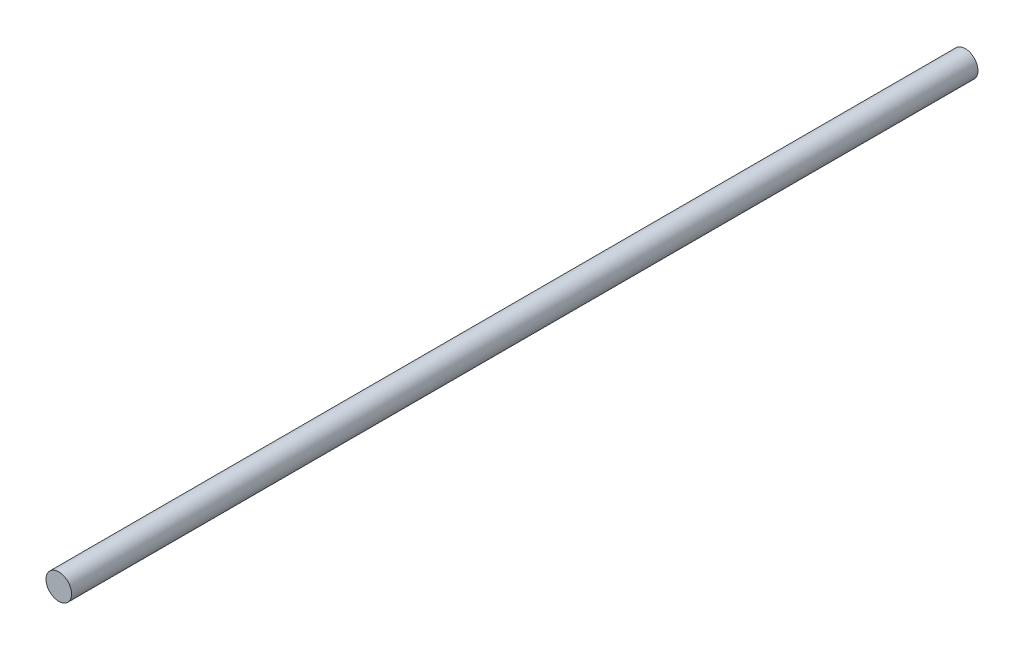
from build123d import *

# Parameters (mm, degrees)
SZKIC1_R                    = 12.5
DODANIE_WYCI_GNI_CIE1_DEPTH = 885


with BuildPart() as part:
    # Szkic1 → Dodanie-wyciągnięcie1 (new body)
    with BuildSketch(Plane.XY):
        Circle(SZKIC1_R)
    extrude(amount=DODANIE_WYCI_GNI_CIE1_DEPTH)


solid = part.part
